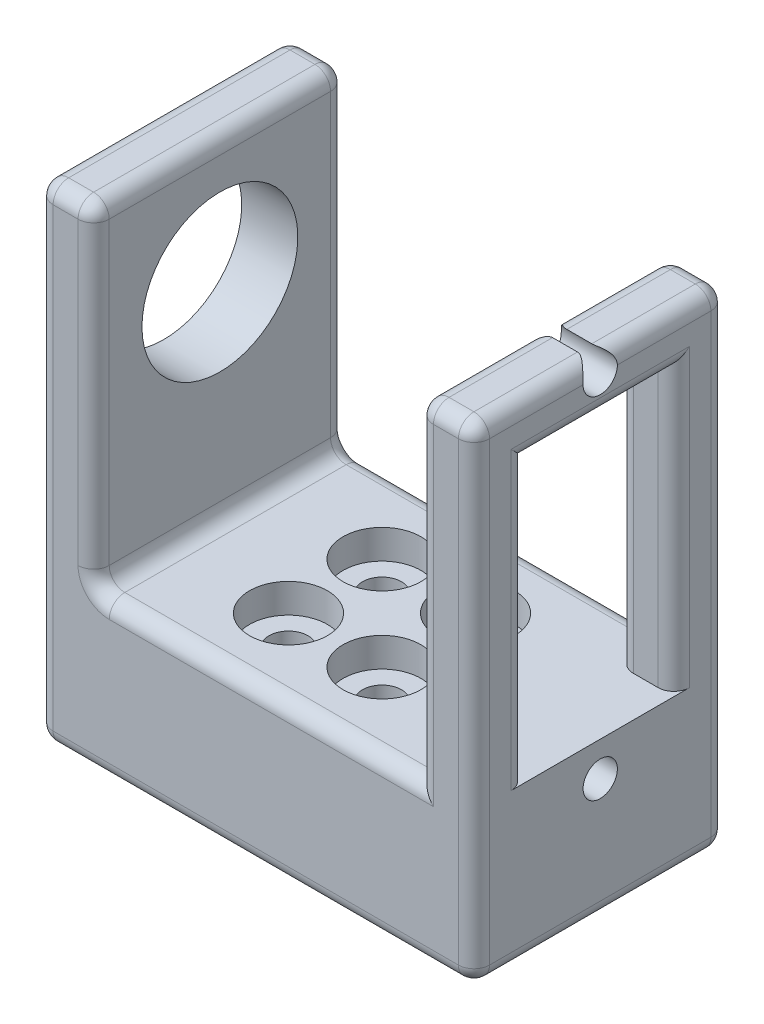
from build123d import *

# Parameters (mm, degrees)
SKETCH1_W                                            = 35.56
SKETCH1_H                                            = 20.574
BOSS_EXTRUDE1_DEPTH                                  = 12.7
SKETCH2_W                                            = 26.416
SKETCH2_H                                            = 11.43
CUT_EXTRUDE1_DEPTH                                   = 6.35
CBORE_FOR_5_16_TRUSS_HEAD_SCREW1_D                   = 3.175
CBORE_FOR_5_16_TRUSS_HEAD_SCREW1_DEPTH               = 7.9375
CBORE_FOR_5_16_TRUSS_HEAD_SCREW1_CBORE_D             = 6.35
CBORE_FOR_5_16_TRUSS_HEAD_SCREW1_CBORE_DEPTH         = 2.38125
CBORE_FOR_5_16_TRUSS_HEAD_SCREW1_TIP                 = 0.953866233
CBORE_FOR_5_16_TRUSS_HEAD_SCREW1_ON_FACE_D           = 3.175
CBORE_FOR_5_16_TRUSS_HEAD_SCREW1_ON_FACE_DEPTH       = 7.9375
CBORE_FOR_5_16_TRUSS_HEAD_SCREW1_ON_FACE_CBORE_D     = 6.35
CBORE_FOR_5_16_TRUSS_HEAD_SCREW1_ON_FACE_CBORE_DEPTH = 2.38125
CBORE_FOR_5_16_TRUSS_HEAD_SCREW1_ON_FACE_TIP         = 0.953866233
SKETCH5_W                                            = 4.572
SKETCH5_H                                            = 20.574
BOSS_EXTRUDE2_DEPTH                                  = 26.9748
CUT_EXTRUDE2_REACH                                   = 59.113
SKETCH7_W                                            = 11.9888
SKETCH7_H                                            = 22.8092
F_60_0_04_DIAMETER_HOLE1_D                           = 2.794
F_60_0_04_DIAMETER_HOLE1_DEPTH                       = 5.08
F_60_0_04_DIAMETER_HOLE1_TIP                         = 0.839402285
CUT_EXTRUDE3_REACH                                   = 59.113
SKETCH10_R                                           = 6.35
FILLET1_R                                            = 1.27


with BuildPart() as part:
    # Sketch1 → Boss-Extrude1 (new body)
    with BuildSketch(Plane(origin=(0, 0, 0), x_dir=(1, 0, 0), z_dir=(0, 1, 0))):
        with Locations((0, 10.287)):
            Rectangle(SKETCH1_W, SKETCH1_H)
    extrude(amount=BOSS_EXTRUDE1_DEPTH)

    # Sketch2 → Cut-Extrude1 (cut)
    with BuildSketch(Plane.XZ):
        with Locations((0, -10.287)):
            Rectangle(SKETCH2_W, SKETCH2_H)
    extrude(amount=-CUT_EXTRUDE1_DEPTH, mode=Mode.SUBTRACT)

    # CBORE for 5/16 Truss Head Screw1
    with Locations(Plane(origin=(-3.81, 12.7, -14.097), x_dir=(0, 0, 1), z_dir=(0, 1, 0))):
        with Locations((0, 0), (0, 7.62), (7.62, 0), (7.62, 7.62)):
            CounterBoreHole(CBORE_FOR_5_16_TRUSS_HEAD_SCREW1_D / 2, CBORE_FOR_5_16_TRUSS_HEAD_SCREW1_CBORE_D / 2, CBORE_FOR_5_16_TRUSS_HEAD_SCREW1_CBORE_DEPTH, depth=CBORE_FOR_5_16_TRUSS_HEAD_SCREW1_DEPTH)
            with Locations((0, 0, -(CBORE_FOR_5_16_TRUSS_HEAD_SCREW1_DEPTH + CBORE_FOR_5_16_TRUSS_HEAD_SCREW1_TIP / 2))):  # 118° drill point
                Cone(0, CBORE_FOR_5_16_TRUSS_HEAD_SCREW1_D / 2, CBORE_FOR_5_16_TRUSS_HEAD_SCREW1_TIP, mode=Mode.SUBTRACT)

    # CBORE for 5/16 Truss Head Screw1 on face
    with Locations(Plane(origin=(-4.806161328, 124.310596627, 0), x_dir=(0, 0, 1), z_dir=(0, 1, 0))):
        with Locations((0, 0)):
            CounterBoreHole(CBORE_FOR_5_16_TRUSS_HEAD_SCREW1_ON_FACE_D / 2, CBORE_FOR_5_16_TRUSS_HEAD_SCREW1_ON_FACE_CBORE_D / 2, CBORE_FOR_5_16_TRUSS_HEAD_SCREW1_ON_FACE_CBORE_DEPTH, depth=CBORE_FOR_5_16_TRUSS_HEAD_SCREW1_ON_FACE_DEPTH)
            with Locations((0, 0, -(CBORE_FOR_5_16_TRUSS_HEAD_SCREW1_ON_FACE_DEPTH + CBORE_FOR_5_16_TRUSS_HEAD_SCREW1_ON_FACE_TIP / 2))):  # 118° drill point
                Cone(0, CBORE_FOR_5_16_TRUSS_HEAD_SCREW1_ON_FACE_D / 2, CBORE_FOR_5_16_TRUSS_HEAD_SCREW1_ON_FACE_TIP, mode=Mode.SUBTRACT)

    # Sketch5 → Boss-Extrude2 (add)
    with BuildSketch(Plane(origin=(0, 12.7, 0), x_dir=(1, 0, 0), z_dir=(0, 1, 0))):
        with Locations((-15.494, 10.287)):
            Rectangle(SKETCH5_W, SKETCH5_H)
        with Locations((15.494, 10.287)):
            Rectangle(SKETCH5_W, SKETCH5_H)
    extrude(amount=BOSS_EXTRUDE2_DEPTH)

    # Sketch7 → Cut-Extrude2 (cut, up to next)
    with BuildSketch(Plane(origin=(17.78, 0, 0), x_dir=(0, 0, -1), z_dir=(1, 0, 0)), mode=Mode.PRIVATE) as cut_extrude2_sk1:
        with Locations((10.287, 24.1046)):
            Rectangle(SKETCH7_W, SKETCH7_H)
    cut_extrude2_tool1 = extrude(cut_extrude2_sk1.sketch, amount=-CUT_EXTRUDE2_REACH, mode=Mode.PRIVATE) & part.part
    add(cut_extrude2_tool1.solids().sort_by_distance((17.78, 24.1046, -10.287))[0], mode=Mode.SUBTRACT)

    # #60 (0.04) Diameter Hole1
    with Locations(Plane(origin=(17.78, 0, 0), x_dir=(0, 0, -1), z_dir=(1, 0, 0))):
        with Locations((10.287, 38.4048), (10.286762393, 9.906)):
            Hole(F_60_0_04_DIAMETER_HOLE1_D / 2, depth=F_60_0_04_DIAMETER_HOLE1_DEPTH)
            with Locations((0, 0, -(F_60_0_04_DIAMETER_HOLE1_DEPTH + F_60_0_04_DIAMETER_HOLE1_TIP / 2))):  # 118° drill point
                Cone(0, F_60_0_04_DIAMETER_HOLE1_D / 2, F_60_0_04_DIAMETER_HOLE1_TIP, mode=Mode.SUBTRACT)

    # Sketch10 → Cut-Extrude3 (cut, up to next)
    with BuildSketch(Plane.ZY.offset(17.78), mode=Mode.PRIVATE) as cut_extrude3_sk1:
        with Locations((-10.287, 29.464)):
            Circle(SKETCH10_R)
    cut_extrude3_tool1 = extrude(cut_extrude3_sk1.sketch, amount=-CUT_EXTRUDE3_REACH, mode=Mode.PRIVATE) & part.part
    add(cut_extrude3_tool1.solids().sort_by_distance((-17.78, 29.464, -10.287))[0], mode=Mode.SUBTRACT)

    # Fillet1
    fillet1_edges = [part.edges().sort_by_distance(p)[0] for p in [
        (17.78, 39.6748, -15.721493557),
        (13.208, 39.6748, -4.852506443),
        (-13.208, 0, -10.287),
        (0, 0, -16.002),
        (13.208, 0, -10.287),
        (0, 0, -4.572),
        (0, 0, -20.574),
        (17.78, 0, -10.287),
        (0, 0, 0),
        (-17.78, 0, -10.287),
        (0, 12.7, 0),
        (-13.208, 12.7, -10.287),
        (-13.208, 26.1874, 0),
        (-13.208, 26.1874, -20.574),
        (-17.78, 39.6748, -10.287),
        (-15.494, 39.6748, 0),
        (-13.208, 39.6748, -10.287),
        (-15.494, 39.6748, -20.574),
        (0, 12.7, -20.574),
        (-17.78, 19.8374, -20.574),
        (17.78, 19.8374, -20.574),
        (13.208, 26.1874, -20.574),
        (17.78, 19.8374, 0),
        (13.208, 26.1874, 0),
        (17.78, 39.6748, -4.852506443),
        (15.494, 39.6748, -20.574),
        (13.208, 39.6748, -15.721493557),
        (-17.78, 19.8374, 0),
        (15.494, 39.6748, 0),
        (13.208, 35.5092, -10.287),
        (13.208, 24.1046, -16.2814),
        (13.208, 24.1046, -4.2926),
        (17.78, 24.1046, -16.2814),
        (17.78, 35.5092, -10.287),
        (17.78, 24.1046, -4.2926),
    ]]
    fillet(fillet1_edges, radius=FILLET1_R)


solid = part.part
